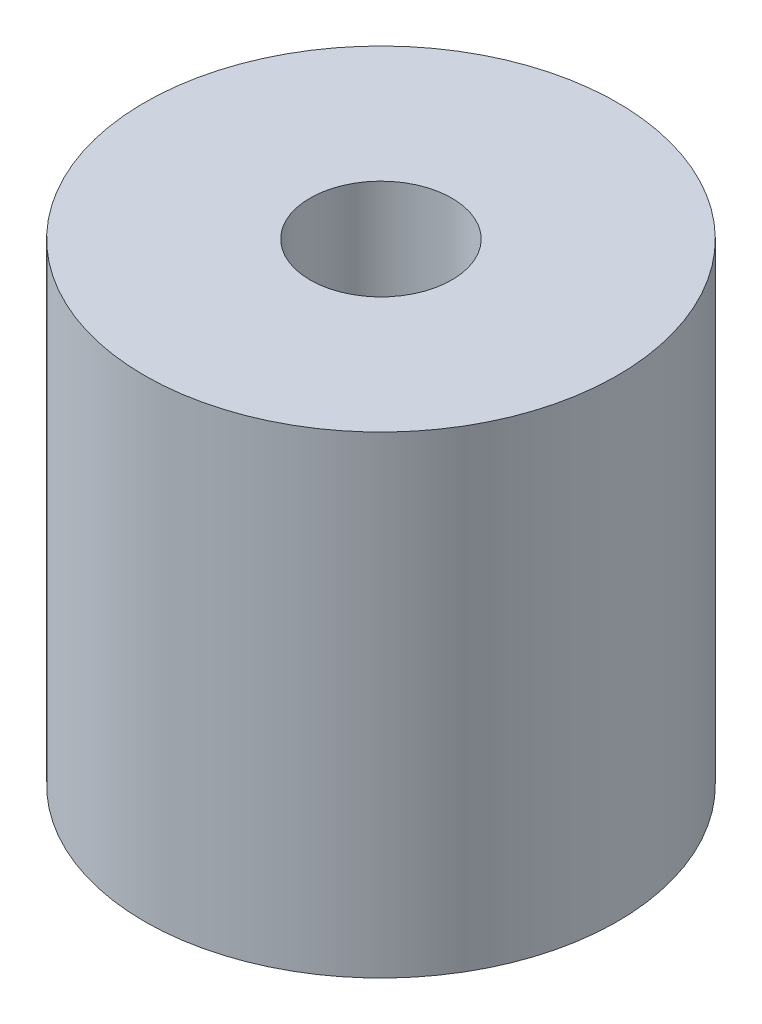
from build123d import *

# Parameters (mm, degrees)
SKETCH1_R           = 2.5
BOSS_EXTRUDE1_DEPTH = 5
SKETCH2_R           = 0.75
CUT_EXTRUDE1_DEPTH  = 5


with BuildPart() as part:
    # Sketch1 → Boss-Extrude1 (new body)
    with BuildSketch(Plane(origin=(0, 0, 0), x_dir=(1, 0, 0), z_dir=(0, 1, 0))):
        with Locations(Location((0, 0, 0), (0, 0, 270))):
            Circle(SKETCH1_R)
    extrude(amount=BOSS_EXTRUDE1_DEPTH)

    # Sketch2 → Cut-Extrude1 (cut)
    with BuildSketch(Plane(origin=(0, 5, 0), x_dir=(1, 0, 0), z_dir=(0, 1, 0))):
        with Locations(Location((0, 0, 0), (0, 0, 270))):
            Circle(SKETCH2_R)
    extrude(amount=-CUT_EXTRUDE1_DEPTH, mode=Mode.SUBTRACT)


solid = part.part
